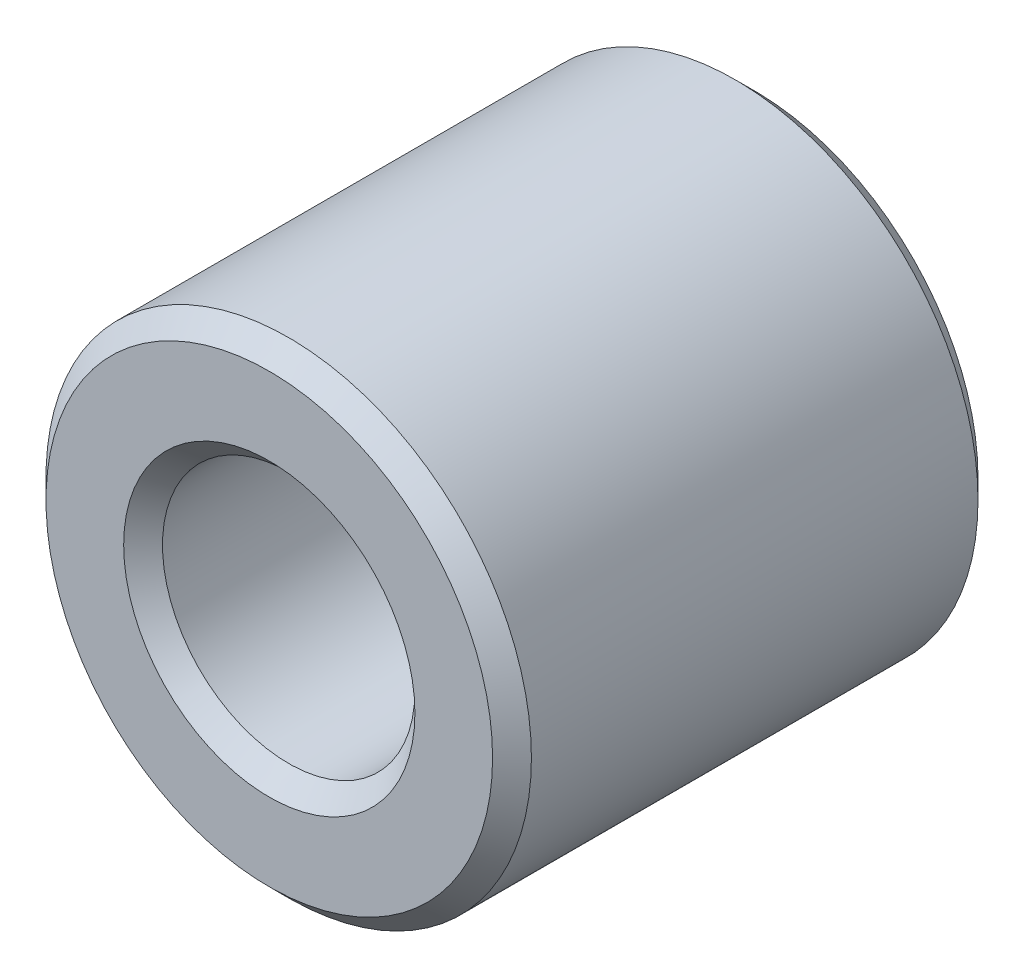
from build123d import *

# Parameters (mm, degrees)
SKETCH1_R           = 3.175
SKETCH1_R_2         = 1.651
BOSS_EXTRUDE1_DEPTH = 6.35
CHAMFER1_SIZE       = 0.254


with BuildPart() as part:
    # Sketch1 → Boss-Extrude1 (new body)
    with BuildSketch(Plane.XY):
        Circle(SKETCH1_R)
        Circle(SKETCH1_R_2, mode=Mode.SUBTRACT)
    extrude(amount=BOSS_EXTRUDE1_DEPTH)

    # Chamfer1
    chamfer1_edges = [part.edges().sort_by_distance(p)[0] for p in [
        (-3.175, 0, 0),
        (-3.175, 0, 6.35),
        (-1.651, 0, 0),
        (-1.651, 0, 6.35),
    ]]
    chamfer(chamfer1_edges, length=CHAMFER1_SIZE)


solid = part.part
